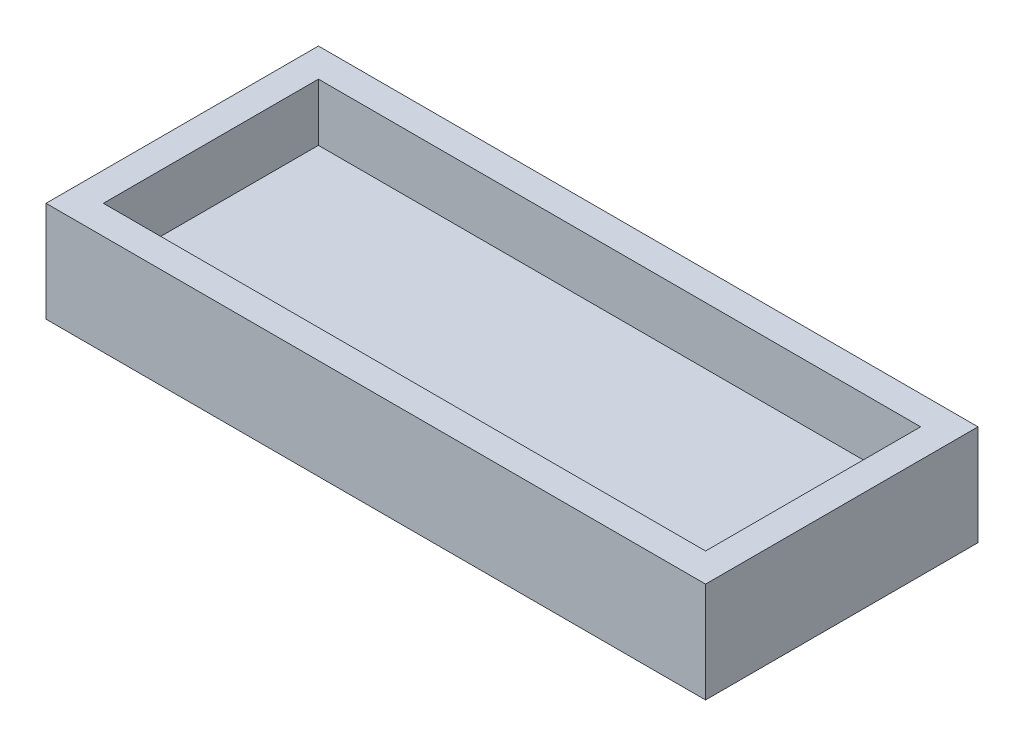
from build123d import *

# Parameters (mm, degrees)
SKETCH1_W           = 42
SKETCH1_H           = 15
BOSS_EXTRUDE1_DEPTH = 3
SKETCH2_W           = 46
SKETCH2_H           = 19
SKETCH2_W_2         = 42
SKETCH2_H_2         = 15
BOSS_EXTRUDE2_DEPTH = 7


with BuildPart() as part:
    # Sketch1 → Boss-Extrude1 (new body)
    with BuildSketch(Plane(origin=(0, 0, 0), x_dir=(1, 0, 0), z_dir=(0, 1, 0))):
        Rectangle(SKETCH1_W, SKETCH1_H)
    extrude(amount=BOSS_EXTRUDE1_DEPTH)

    # Sketch2 → Boss-Extrude2 (add)
    with BuildSketch(Plane.XZ):
        Rectangle(SKETCH2_W, SKETCH2_H)
        Rectangle(SKETCH2_W_2, SKETCH2_H_2, mode=Mode.SUBTRACT)
    extrude(amount=-BOSS_EXTRUDE2_DEPTH)


solid = part.part
